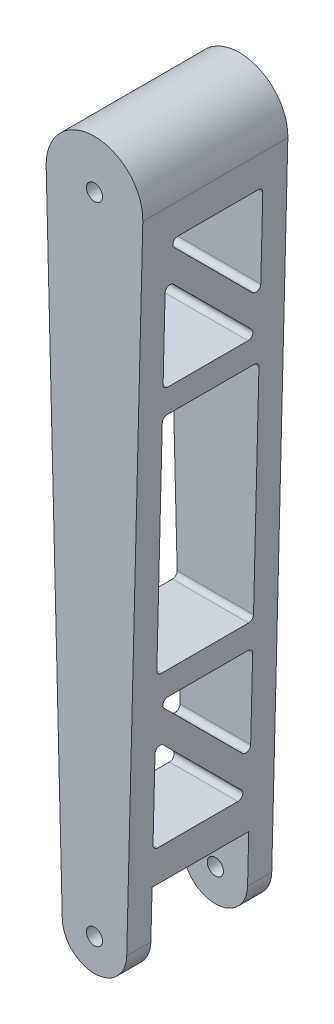
from build123d import *

# Parameters (mm, degrees)
SKETCH_1_R               = 5
EXTRUDE_1_DEPTH          = 90
CUT_EXTRUDE_1_DEPTH      = 431.581002832
CUT_EXTRUDE_1_DEPTH_BACK = 431.581002832
SKETCH_2_W               = 60
SKETCH_2_H               = 150
SKETCH_2_H_2             = 140.75
FILLET_1_R               = 3


with BuildPart() as part:
    # 草图1 → 凸台-拉伸1 (new body)
    with BuildSketch(Plane.XY):
        with BuildLine():
            Line((-29.990623535, -0.75), (-19.993749023, -400.5))
            ThreePointArc((-19.993749023, -400.5), (0, -420), (19.993749023, -400.5))
            Line((19.993749023, -400.5), (29.990623535, -0.75))
            ThreePointArc((29.990623535, -0.75), (0, 30), (-29.990623535, -0.75))
        make_face()
        with Locations(Location((0, 0, 0), (0, 0, 180))):
            Circle(SKETCH_1_R, mode=Mode.SUBTRACT)
        with Locations(Location((0, -400, 0), (0, 0, 180))):
            Circle(SKETCH_1_R, mode=Mode.SUBTRACT)
    extrude(amount=EXTRUDE_1_DEPTH)

    # 草图2 → 切除-拉伸1 (cut, two sides: drawn at the far end of the back side and taken through both)
    with BuildSketch(Plane(origin=(0, 0, 0), x_dir=(0, 0, -1), z_dir=(1, 0, 0)).offset(-CUT_EXTRUDE_1_DEPTH_BACK)):
        with Locations((-45, -445.75)):
            Rectangle(SKETCH_2_W, SKETCH_2_H)
        Polygon((-75, -20), (-15, -20), (-15, -80), align=None)
        Polygon((-75, -40), (-75, -100), (-15, -100), align=None)
        Polygon((-15, -330.75), (-75, -270.75), (-15, -270.75), align=None)
        Polygon((-15, -350.75), (-75, -290.75), (-75, -350.75), align=None)
        with Locations((-45, -185.375)):
            Rectangle(SKETCH_2_W, SKETCH_2_H_2)
    extrude(amount=CUT_EXTRUDE_1_DEPTH + CUT_EXTRUDE_1_DEPTH_BACK, mode=Mode.SUBTRACT)

    # 圆角1
    fillet_1_edges = [part.edges().sort_by_distance(p)[0] for p in [
        (0, -270.75, 75),
        (0, -270.75, 15),
        (0, -330.75, 15),
        (0, -255.75, 75),
        (0, -115, 75),
        (0, -115, 15),
        (0, -255.75, 15),
        (0, -350.75, 15),
        (0, -350.75, 75),
        (0, -290.75, 75),
        (0, -40, 75),
        (0, -100, 15),
        (0, -100, 75),
        (0, -80, 15),
        (0, -20, 75),
        (0, -20, 15),
    ]]
    fillet(fillet_1_edges, radius=FILLET_1_R)


solid = part.part
